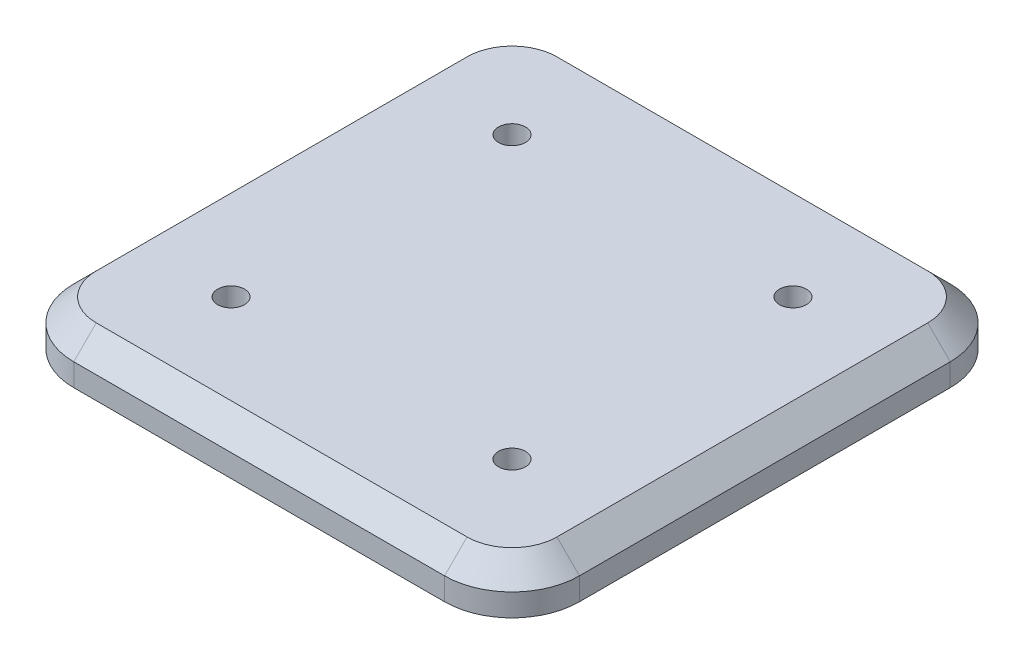
from build123d import *

# Parameters (mm, degrees)
SKETCH_1_W          = 225
SKETCH_1_H          = 225
EXTRUDE_1_DEPTH     = 20
FILLET_1_R          = 30
CHAMFER_1_SIZE      = 10
HOLE_WIZARD_1_D     = 12
HOLE_WIZARD_1_DEPTH = 10
HOLE_WIZARD_1_TIP   = 3.605163714
HOLE_WIZARD_2_D     = 12
HOLE_WIZARD_2_DEPTH = 10
HOLE_WIZARD_2_TIP   = 3.605163714


with BuildPart() as part:
    # 草圖1 → 擠出1 (new body)
    with BuildSketch(Plane(origin=(0, 0, 0), x_dir=(-1, 0, 0), z_dir=(0, 1, 0))):
        Rectangle(SKETCH_1_W, SKETCH_1_H)
    extrude(amount=EXTRUDE_1_DEPTH)

    # 圓角1
    fillet_1_edges = [part.edges().sort_by_distance(p)[0] for p in [
        (-112.5, 10, -112.5),
        (112.5, 10, -112.5),
        (112.5, 10, 112.5),
        (-112.5, 10, 112.5),
    ]]
    fillet(fillet_1_edges, radius=FILLET_1_R)

    # 倒角1
    chamfer_1_edges = [part.edges().sort_by_distance(p)[0] for p in [
        (0, 20, 112.5),
        (-112.5, 20, 0),
        (112.5, 20, 0),
        (0, 20, -112.5),
        (103.713203436, 20, 103.713203436),
        (103.713203436, 20, -103.713203436),
        (-103.713203436, 20, -103.713203436),
        (-103.713203436, 20, 103.713203436),
    ]]
    chamfer(chamfer_1_edges, length=CHAMFER_1_SIZE)

    # 孔1
    with Locations(Plane(origin=(0, 0, 0), x_dir=(-1, 0, 0), z_dir=(0, -1, 0))):
        with Locations((-87.5, 87.5), (-87.5, -87.5), (87.5, -87.5), (87.5, 87.5)):
            Hole(HOLE_WIZARD_1_D / 2, depth=HOLE_WIZARD_1_DEPTH)
            with Locations((0, 0, -(HOLE_WIZARD_1_DEPTH + HOLE_WIZARD_1_TIP / 2))):  # 118° drill point
                Cone(0, HOLE_WIZARD_1_D / 2, HOLE_WIZARD_1_TIP, mode=Mode.SUBTRACT)

    # 孔2
    with Locations(Plane(origin=(0, 20, 0), x_dir=(1, 0, 0), z_dir=(0, 1, 0))):
        with Locations((-62.5, 62.5), (62.5, 62.5), (62.5, -62.5), (-62.5, -62.5)):
            Hole(HOLE_WIZARD_2_D / 2, depth=HOLE_WIZARD_2_DEPTH)
            with Locations((0, 0, -(HOLE_WIZARD_2_DEPTH + HOLE_WIZARD_2_TIP / 2))):  # 118° drill point
                Cone(0, HOLE_WIZARD_2_D / 2, HOLE_WIZARD_2_TIP, mode=Mode.SUBTRACT)


solid = part.part
